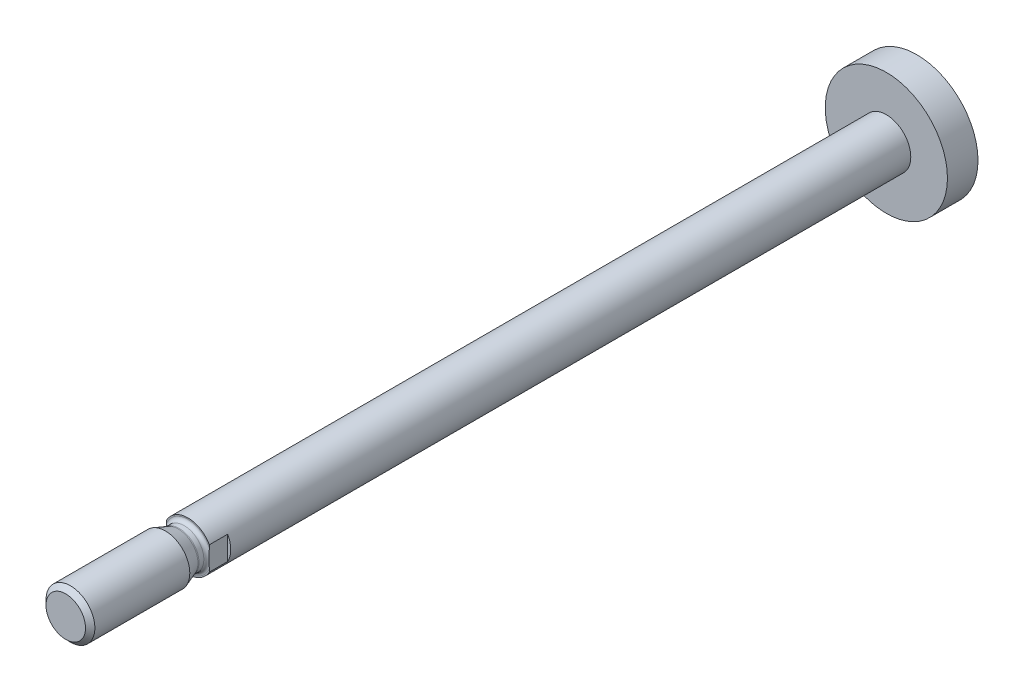
from build123d import *

# Parameters (mm, degrees)
CUT_EXTRUDE1_DEPTH = 4


with BuildPart() as part:
    # Sketch1 → Revolve1 (revolve)
    with BuildSketch(Plane(origin=(0, 0, 0), x_dir=(0, 0, -1), z_dir=(1, 0, 0))):
        Polygon((-4, 0), (-4, 4), (110.3, 4), (110.3, 10), (115.3, 10), (115.3, 0), align=None)
    revolve(axis=Axis((0, 0, -115.3), (0, 0, 1)))

    # Sketch2 → Revolve2 (revolve)
    with BuildSketch(Plane(origin=(0, 0, 0), x_dir=(0, 0, -1), z_dir=(1, 0, 0))):
        with BuildLine():
            Line((-24, 0), (-24, 3.233))
            Line((-24, 3.233), (-23.233, 4))
            Line((-23.233, 4), (-7.697981936, 4))
            Line((-7.697981936, 4), (-5.599415898, 3.236184428))
            ThreePointArc((-5.599415898, 3.236184428), (-5.498392718, 3.209115348), (-5.394203812, 3.2))
            Line((-5.394203812, 3.2), (-4.6, 3.2))
            ThreePointArc((-4.6, 3.2), (-4.175735931, 3.375735931), (-4, 3.8))
            Line((-4, 3.8), (-4, 4))
            Line((-4, 4), (-3, 4))
            Line((-3, 4), (-3, 0))
            Line((-3, 0), (-24, 0))
        make_face()
    revolve(axis=Axis((0, 0, 3), (0, 0, 1)))

    # Sketch3 → Cut-Extrude1 (cut)
    with BuildSketch(Plane.XY.offset(1)):
        Polygon((-7, 14), (-7, -7), (-3.5, -7), (-3.5, 7), (3.5, 7), (3.5, -7), (7, -7), (7, 14), align=None)
    extrude(amount=CUT_EXTRUDE1_DEPTH, mode=Mode.SUBTRACT)


solid = part.part
